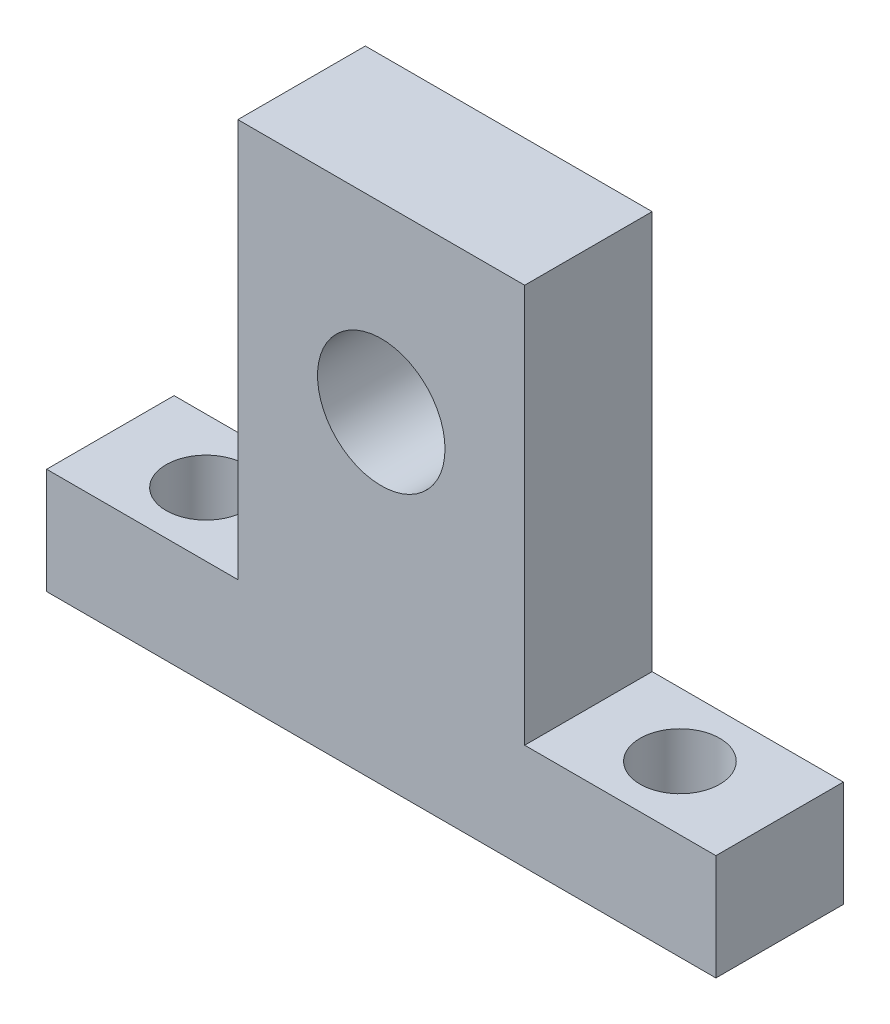
from build123d import *

# Parameters (mm, degrees)
SKETCH2_R           = 4
BOSS_EXTRUDE1_DEPTH = 8
SKETCH3_R           = 2.5
CUT_EXTRUDE1_DEPTH  = 6.65


with BuildPart() as part:
    # Sketch2 → Boss-Extrude1 (new body)
    with BuildSketch(Plane.XY):
        Polygon((-32.285858586, 18.527272727), (-32.285858586, 25.177272727), (-20.285858586, 25.177272727), (-20.285858586, 50.177272727), (-2.285858586, 50.177272727), (-2.285858586, 25.177272727), (9.714141414, 25.177272727), (9.714141414, 18.527272727), align=None)
        with Locations((-11.285858586, 38.777272727)):
            Circle(SKETCH2_R, mode=Mode.SUBTRACT)
    extrude(amount=BOSS_EXTRUDE1_DEPTH)

    # Sketch3 → Cut-Extrude1 (cut)
    with BuildSketch(Plane(origin=(0, 25.177272727, 0), x_dir=(1, 0, 0), z_dir=(0, 1, 0))):
        with Locations(Location((-26.285858586, -4, 0), (0, 0, 270))):
            Circle(SKETCH3_R)
        with Locations(Location((3.45668569, -4, 0), (0, 0, 270))):
            Circle(SKETCH3_R)
    extrude(amount=-CUT_EXTRUDE1_DEPTH, mode=Mode.SUBTRACT)


solid = part.part
